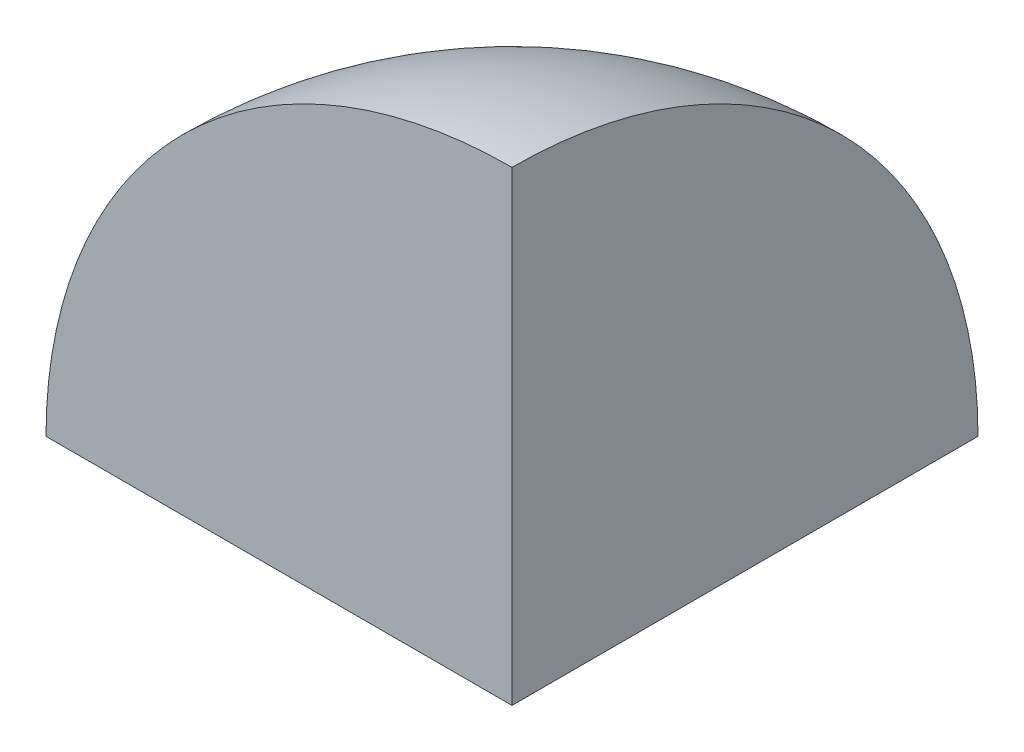
from build123d import *


with BuildPart() as part:
    # Эскиз5 → Повернуть1 (revolve)
    with BuildSketch(Plane(origin=(-13.435, 0, 0), x_dir=(0, 0, -1), z_dir=(1, 0, 0))):
        with BuildLine():
            Line((-10.564971157, 26.87), (37.435028843, 26.87))
            ThreePointArc((37.435028843, 26.87), (13.435028843, 50.87), (-10.564971157, 26.87))
        make_face()
    revolve(axis=Axis((-13.435, 26.87, 10.564971157), (0, 0, -1)))

    # Эскиз6 → Повернуть5 (revolve)
    with BuildSketch(Plane.XY.offset(-13.435)):
        with BuildLine():
            Line((11.565, 26.87), (10.565, 26.87))
            ThreePointArc((10.565, 26.87), (8.476163819, 36.662900494), (2.573258326, 44.751153916))
            ThreePointArc((2.573258326, 44.751153916), (9.190506837, 36.877335856), (11.565, 26.87))
        make_face()
    revolve(axis=Axis((11.565, 26.87, -13.435), (-1, 0, 0)))

    # Surface Cut 1
    split(bisect_by=Plane(origin=(0, 26.87, 0), x_dir=(1, 0, 0), z_dir=(0, 1, 0)), keep=Keep.TOP)

    # Surface Cut 3
    split(bisect_by=Plane(origin=(-13.435, 0, 0), x_dir=(0, 0, -1), z_dir=(1, 0, 0)), keep=Keep.BOTTOM)

    # Surface Cut 7
    split(bisect_by=Plane.XY.offset(-13.435), keep=Keep.BOTTOM)


solid = part.part
